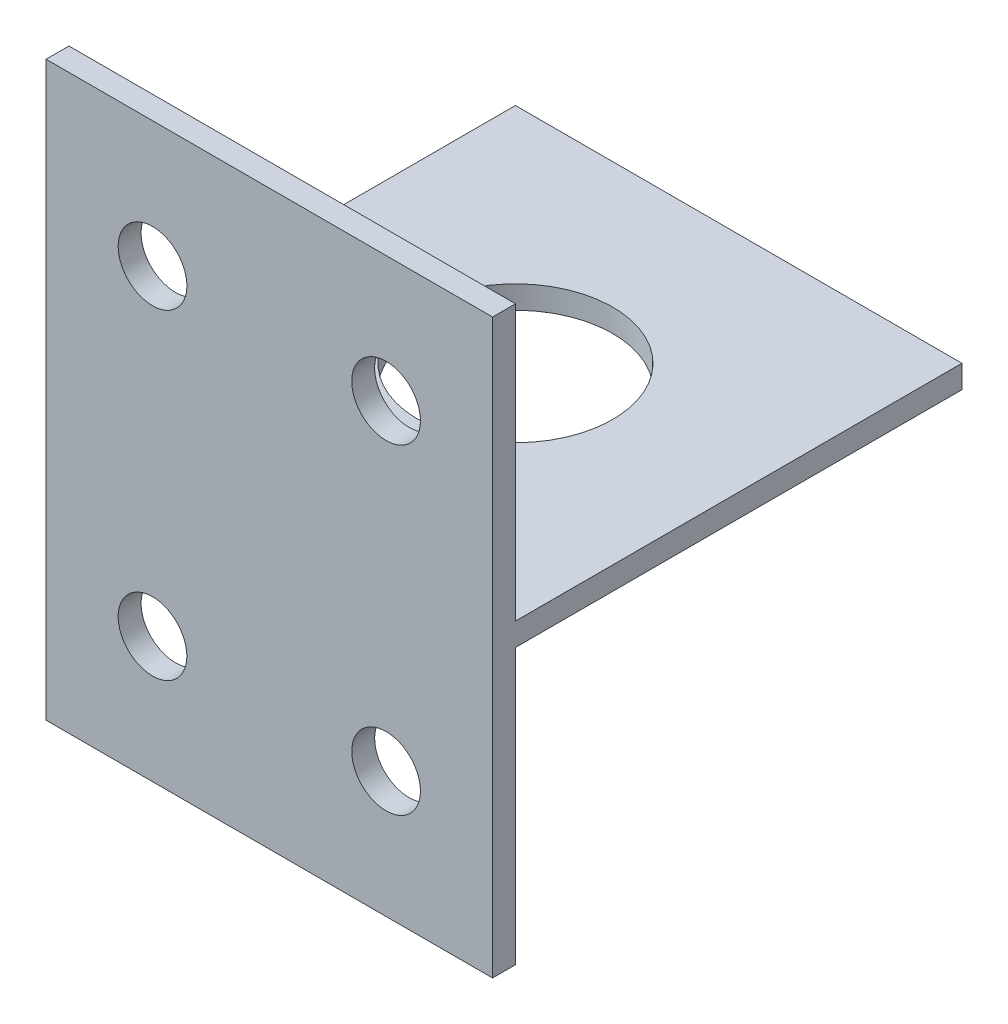
from build123d import *

# Parameters (mm, degrees)
SKETCH_1_W          = 19.5
SKETCH_1_H          = 25
EXTRUDE_1_DEPTH     = 1
SKETCH_2_W          = 19.5
SKETCH_2_H          = 1
EXTRUDE_2_DEPTH     = 19.5
SKETCH_3_R          = 1.5
CUT_EXTRUDE_1_DEPTH = 26.130907266
SKETCH_4_R          = 4.25
CUT_EXTRUDE_2_DEPTH = 26.383311447


with BuildPart() as part:
    # 草图1 → 凸台-拉伸1 (new body)
    with BuildSketch(Plane.XY):
        Rectangle(SKETCH_1_W, SKETCH_1_H)
    extrude(amount=EXTRUDE_1_DEPTH)

    # 草图2 → 凸台-拉伸2 (add)
    with BuildSketch(Plane(origin=(0, 0, 0), x_dir=(-1, 0, 0), z_dir=(0, 0, -1))):
        Rectangle(SKETCH_2_W, SKETCH_2_H)
    extrude(amount=EXTRUDE_2_DEPTH)

    # 草图3 → 切除-拉伸1 (cut, through all)
    with BuildSketch(Plane(origin=(0, 0, 0), x_dir=(-1, 0, 0), z_dir=(0, 0, -1))):
        with Locations((5.100590272, 7.002287459)):
            Circle(SKETCH_3_R)
        with Locations(Location((-5.100590272, 7.002287459, 0), (0, 0, 180))):
            Circle(SKETCH_3_R)
        with Locations(Location((5.100590272, -7.002287459, 0), (0, 0, 180))):
            Circle(SKETCH_3_R)
        with Locations((-5.100590272, -7.002287459)):
            Circle(SKETCH_3_R)
    extrude(amount=-CUT_EXTRUDE_1_DEPTH, mode=Mode.SUBTRACT)

    # 草图4 → 切除-拉伸2 (cut, through all)
    with BuildSketch(Plane(origin=(0, 0.5, 0), x_dir=(1, 0, 0), z_dir=(0, 1, 0))):
        with Locations(Location((0, 9.75, 0), (0, 0, 180))):
            Circle(SKETCH_4_R)
    extrude(amount=-CUT_EXTRUDE_2_DEPTH, mode=Mode.SUBTRACT)


solid = part.part
